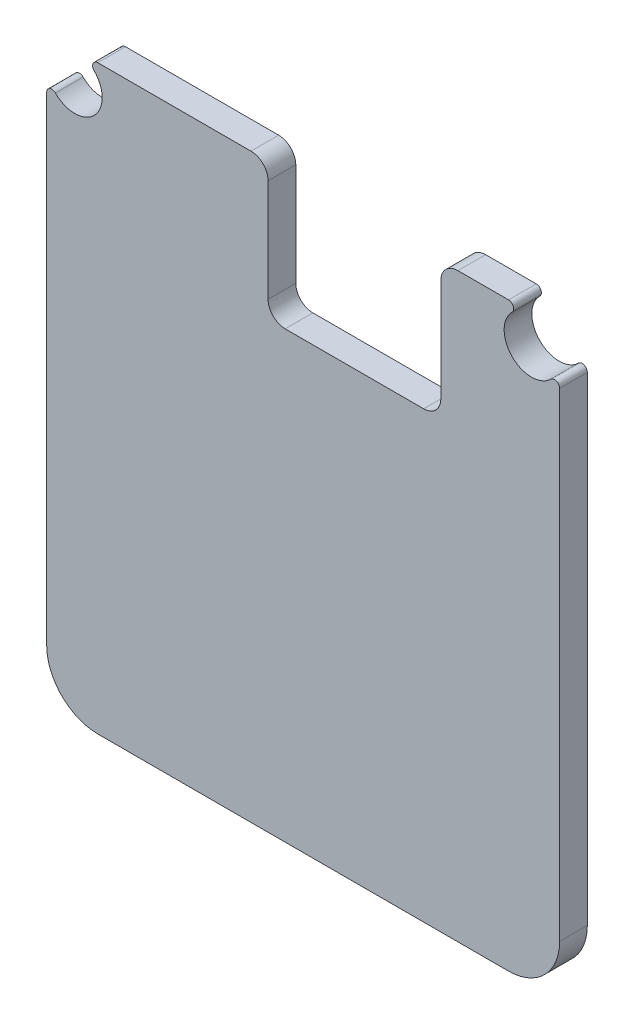
from build123d import *

# Parameters (mm, degrees)
BOARD_DEPTH = 1.6194


with BuildPart() as part:
    # Sketch1 → Board (new body)
    with BuildSketch(Plane.XY):
        with BuildLine():
            Line((10, 29), (10, 57.01299))
            ThreePointArc((10, 57.01299), (10.185190901, 57.290158106), (10.51213, 57.22513))
            ThreePointArc((10.51213, 57.22513), (12.777621512, 57.222368475), (12.77487, 59.48786))
            ThreePointArc((12.77487, 59.48786), (12.709829188, 59.814802566), (12.987, 60))
            Line((12.987, 60), (21.95, 60))
            ThreePointArc((21.95, 60), (22.657106781, 59.707106781), (22.95, 59))
            Line((22.95, 59), (22.95, 53))
            ThreePointArc((22.95, 53), (23.242893219, 52.292893219), (23.95, 52))
            Line((23.95, 52), (32.05, 52))
            ThreePointArc((32.05, 52), (32.757106781, 52.292893219), (33.05, 53))
            Line((33.05, 53), (33.05, 59))
            ThreePointArc((33.05, 59), (33.342893219, 59.707106781), (34.05, 60))
            Line((34.05, 60), (37.01299, 60))
            ThreePointArc((37.01299, 60), (37.290150019, 59.814804479), (37.22512, 59.48787))
            ThreePointArc((37.22512, 59.48787), (37.223732391, 57.223742391), (39.48786, 57.22513))
            ThreePointArc((39.48786, 57.22513), (39.814807186, 57.290168899), (40, 57.01299))
            Line((40, 57.01299), (40, 29))
            ThreePointArc((40, 29), (39.121323273, 26.878676727), (37, 26))
            Line((37, 26), (13, 26))
            ThreePointArc((13, 26), (10.878679656, 26.878679656), (10, 29))
        make_face()
    extrude(amount=BOARD_DEPTH)


solid = part.part
